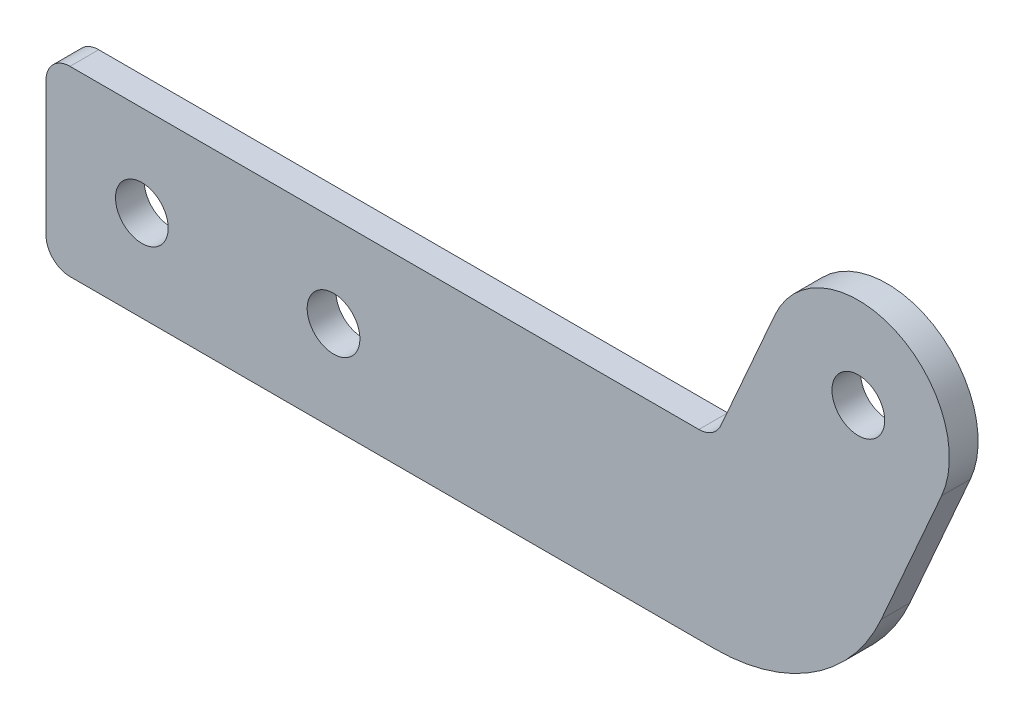
from build123d import *

# Parameters (mm, degrees)
BOSS_EXTRUDE1_DEPTH  = 3
M5_CLEARANCE_HOLE1_D = 5.5
M5_CLEARANCE_HOLE2_D = 5.5
M5_CLEARANCE_HOLE3_D = 5.5
FILLET2_R            = 2.5


with BuildPart() as part:
    # Sketch1 → Boss-Extrude1 (new body)
    with BuildSketch(Plane.XY):
        with BuildLine():
            Line((8.695255676, -3.826555727), (2.390511351, -18.153111454))
            ThreePointArc((2.390511351, -18.153111454), (-4.61754166, -26.412402673), (-15, -29.5))
            Line((-15, -29.5), (-84.75, -29.5))
            Line((-84.75, -29.5), (-84.75, -10.5))
            Line((-84.75, -10.5), (-15, -10.5))
            Line((-15, -10.5), (-8.695255676, 3.826555727))
            ThreePointArc((-8.695255676, 3.826555727), (3.826555727, 8.695255676), (8.695255676, -3.826555727))
        make_face()
    extrude(amount=BOSS_EXTRUDE1_DEPTH)

    # M5 Clearance Hole1 (through all)
    with Locations(Plane.XY.offset(3)):
        with Locations((-74.75, -20)):
            Hole(M5_CLEARANCE_HOLE1_D / 2)

    # M5 Clearance Hole2 (through all)
    with Locations(Plane.XY.offset(3)):
        with Locations((-54.75, -20)):
            Hole(M5_CLEARANCE_HOLE2_D / 2)

    # M5 Clearance Hole3 (through all)
    with Locations(Plane.XY.offset(3)):
        with Locations((0, 0)):
            Hole(M5_CLEARANCE_HOLE3_D / 2)

    # Fillet2
    fillet2_edges = [part.edges().sort_by_distance(p)[0] for p in [
        (-84.75, -29.5, 1.5),
        (-84.75, -10.5, 1.5),
        (-15, -10.5, 1.5),
    ]]
    fillet(fillet2_edges, radius=FILLET2_R)


solid = part.part
